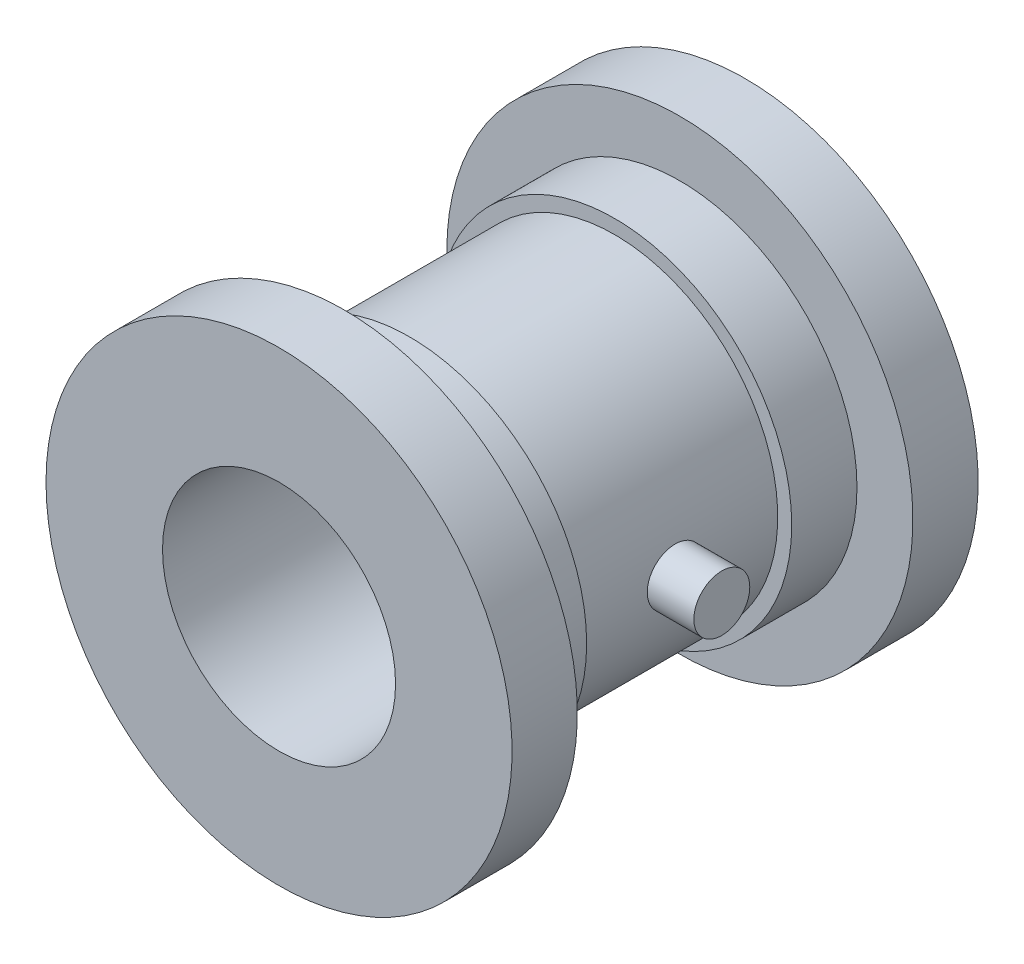
from build123d import *

# Parameters (mm, degrees)
SKETCH2_R           = 2
CUT_EXTRUDE2_DEPTH  = 78
SKETCH3_R           = 3
BOSS_EXTRUDE1_DEPTH = 5


with BuildPart() as part:
    # Sketch1 → Revolve1 (revolve)
    with BuildSketch(Plane(origin=(0, 0, 0), x_dir=(0, 0, -1), z_dir=(1, 0, 0)), mode=Mode.PRIVATE) as revolve1_sk:
        Polygon((-11, 19), (-11, 17.5), (11, 17.5), (11, 19), (18, 19), (18, 25), (25, 25), (25, 12.5), (-25, 12.5), (-25, 25), (-18, 25), (-18, 19), align=None)
    revolve(revolve1_sk.sketch.rotate(Axis((0, 0, -158.679414735), (0, 0, 1)), 90), axis=Axis((0, 0, -158.679414735), (0, 0, 1)))

    # Sketch2 → Cut-Extrude2 (cut)
    with BuildSketch(Plane(origin=(0, 0, 0), x_dir=(0, 0, -1), z_dir=(1, 0, 0))):
        Circle(SKETCH2_R)
    extrude(amount=-CUT_EXTRUDE2_DEPTH, mode=Mode.SUBTRACT)


with BuildPart() as body_2:
    # Sketch3 → Boss-Extrude1 (new body)
    with BuildSketch(Plane(origin=(17.5, 0, 0), x_dir=(0, 0, -1), z_dir=(1, 0, 0))):
        Circle(SKETCH3_R)
    extrude(amount=BOSS_EXTRUDE1_DEPTH)


solid = Compound([part.part, body_2.part])
